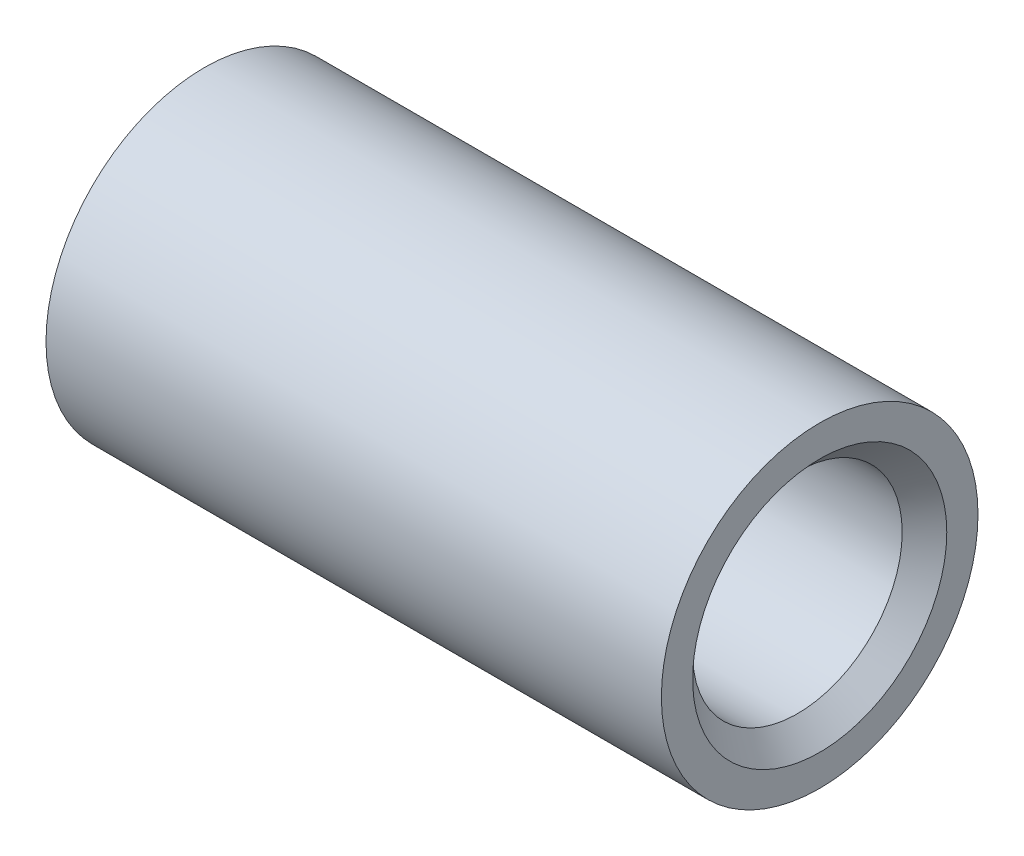
from build123d import *


with BuildPart() as part:
    # Sketch1 → Revolve1 (revolve)
    with BuildSketch(Plane.XY, mode=Mode.PRIVATE) as revolve1_sk:
        Polygon((-1.9, 0), (-1.9, 2.35), (-6.4, 2.35), (-6.9, 2.85), (-6.9, 3.55), (6.9, 3.55), (6.9, 2.85), (6.4, 2.35), (1.9, 2.35), (1.9, 0), align=None)
    revolve(revolve1_sk.sketch.rotate(Axis((0, 0, 0), (-1, 0, 0)), 90), axis=Axis((0, 0, 0), (-1, 0, 0)))


solid = part.part
